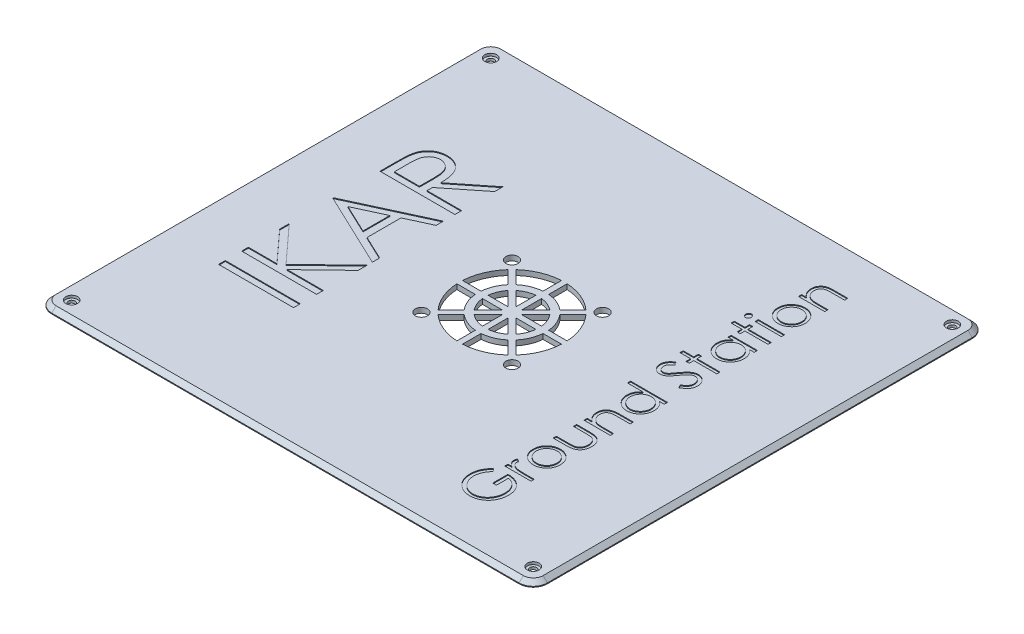
from build123d import *

# Parameters (mm, degrees)
SZKIC1_W                    = 175
SZKIC1_H                    = 160
DODANIE_WYCI_GNI_CIE1_DEPTH = 1.8
ZAOKR_GLENIE1_R             = 5
SZKIC2_R                    = 1.2
WYTNIJ_WYCI_GNI_CIE1_DEPTH  = 119.572720303
SZKIC3_R                    = 2.15
WYTNIJ_WYCI_GNI_CIE2_DEPTH  = 119.572720303
SZKIC5_R                    = 2.1
WYTNIJ_WYCI_GNI_CIE3_DEPTH  = 0.9
SFAZOWANIE2_SIZE            = 1.5
SZKIC6_W                    = 26.458333333
SZKIC6_H                    = 2.374465812
SZKIC6_W_2                  = 9.280769231
SZKIC6_H_2                  = 1.13974359
WYTNIJ_WYCI_GNI_CIE4_DEPTH  = 0.3


with BuildPart() as part:
    # Szkic1 → Dodanie-wyciągnięcie1 (new body)
    with BuildSketch(Plane(origin=(0, 0, 0), x_dir=(1, 0, 0), z_dir=(0, 1, 0))):
        Rectangle(SZKIC1_W, SZKIC1_H)
    extrude(amount=DODANIE_WYCI_GNI_CIE1_DEPTH)

    # Zaokrąglenie1
    zaokr_glenie1_edges = [part.edges().sort_by_distance(p)[0] for p in [
        (-87.5, 0.9, -80),
        (87.5, 0.9, -80),
        (87.5, 0.9, 80),
        (-87.5, 0.9, 80),
    ]]
    fillet(zaokr_glenie1_edges, radius=ZAOKR_GLENIE1_R)

    # Szkic2 → Wytnij-wyciągnięcie1 (cut, through all)
    with BuildSketch(Plane(origin=(0, 1.8, 0), x_dir=(1, 0, 0), z_dir=(0, 1, 0))):
        with Locations(Location((-81.5, 74, 0), (0, 0, 270))):
            Circle(SZKIC2_R)
        with Locations(Location((81.5, 74, 0), (0, 0, 270))):
            Circle(SZKIC2_R)
        with Locations(Location((81.5, -74, 0), (0, 0, 90))):
            Circle(SZKIC2_R)
        with Locations(Location((-81.5, -74, 0), (0, 0, 90))):
            Circle(SZKIC2_R)
    extrude(amount=-WYTNIJ_WYCI_GNI_CIE1_DEPTH, mode=Mode.SUBTRACT)

    # Szkic3 → Wytnij-wyciągnięcie2 (cut, through all)
    with BuildSketch(Plane(origin=(0, 1.8, 0), x_dir=(1, 0, 0), z_dir=(0, 1, 0))):
        with Locations(Location((-16, -16, 0), (0, 0, 270))):
            Circle(SZKIC3_R)
        with Locations(Location((16, -16, 0), (0, 0, 270))):
            Circle(SZKIC3_R)
        with Locations(Location((16, 16, 0), (0, 0, 270))):
            Circle(SZKIC3_R)
        with Locations(Location((-16, 16, 0), (0, 0, 270))):
            Circle(SZKIC3_R)
        with BuildLine():
            ThreePointArc((-13.769457259, 12.355243696), (-17.091771351, 7.079643499), (-18.472953202, 1))
            Line((-18.472953202, 1), (-11.958260743, 1))
            ThreePointArc((-11.958260743, 1), (-11.08655439, 4.592201188), (-9.162874044, 7.748660481))
            Line((-9.162874044, 7.748660481), (-13.769457259, 12.355243696))
        make_face()
        with BuildLine():
            ThreePointArc((-1, 18.472953202), (-7.079643499, 17.091771351), (-12.355243696, 13.769457259))
            Line((-12.355243696, 13.769457259), (-7.748660481, 9.162874044))
            ThreePointArc((-7.748660481, 9.162874044), (-4.592201188, 11.08655439), (-1, 11.958260743))
            Line((-1, 11.958260743), (-1, 18.472953202))
        make_face()
        with BuildLine():
            Line((7.748660481, 9.162874044), (12.355243696, 13.769457259))
            ThreePointArc((12.355243696, 13.769457259), (7.079643499, 17.091771351), (1, 18.472953202))
            Line((1, 18.472953202), (1, 11.958260743))
            ThreePointArc((1, 11.958260743), (4.592201188, 11.08655439), (7.748660481, 9.162874044))
        make_face()
        with BuildLine():
            Line((11.958260743, 1), (18.472953202, 1))
            ThreePointArc((18.472953202, 1), (17.091771351, 7.079643499), (13.769457259, 12.355243696))
            Line((13.769457259, 12.355243696), (9.162874044, 7.748660481))
            ThreePointArc((9.162874044, 7.748660481), (11.08655439, 4.592201188), (11.958260743, 1))
        make_face()
        with BuildLine():
            Line((9.162874044, -7.748660481), (13.769457259, -12.355243696))
            ThreePointArc((13.769457259, -12.355243696), (17.091771351, -7.079643499), (18.472953202, -1))
            Line((18.472953202, -1), (11.958260743, -1))
            ThreePointArc((11.958260743, -1), (11.08655439, -4.592201188), (9.162874044, -7.748660481))
        make_face()
        with BuildLine():
            ThreePointArc((7.748660481, -9.162874044), (4.592201188, -11.08655439), (1, -11.958260743))
            Line((1, -11.958260743), (1, -18.472953202))
            ThreePointArc((1, -18.472953202), (7.079643499, -17.091771351), (12.355243696, -13.769457259))
            Line((12.355243696, -13.769457259), (7.748660481, -9.162874044))
        make_face()
        with BuildLine():
            ThreePointArc((-18.472953202, -1), (-17.091771351, -7.079643499), (-13.769457259, -12.355243696))
            Line((-13.769457259, -12.355243696), (-9.162874044, -7.748660481))
            ThreePointArc((-9.162874044, -7.748660481), (-11.08655439, -4.592201188), (-11.958260743, -1))
            Line((-11.958260743, -1), (-18.472953202, -1))
        make_face()
        with BuildLine():
            ThreePointArc((-12.355243696, -13.769457259), (-7.079643499, -17.091771351), (-1, -18.472953202))
            Line((-1, -18.472953202), (-1, -11.958260743))
            ThreePointArc((-1, -11.958260743), (-4.592201188, -11.08655439), (-7.748660481, -9.162874044))
            Line((-7.748660481, -9.162874044), (-12.355243696, -13.769457259))
        make_face()
        with BuildLine():
            Line((-1, -2.414213562), (-5.973087827, -7.387301389))
            ThreePointArc((-5.973087827, -7.387301389), (-3.635492607, -8.776855559), (-1, -9.447221814))
            Line((-1, -9.447221814), (-1, -2.414213562))
        make_face()
        with BuildLine():
            Line((-2.414213562, -1), (-9.447221814, -1))
            ThreePointArc((-9.447221814, -1), (-8.776855559, -3.635492607), (-7.387301389, -5.973087827))
            Line((-7.387301389, -5.973087827), (-2.414213562, -1))
        make_face()
        with BuildLine():
            Line((-2.414213562, 1), (-7.387301389, 5.973087827))
            ThreePointArc((-7.387301389, 5.973087827), (-8.776855559, 3.635492607), (-9.447221814, 1))
            Line((-9.447221814, 1), (-2.414213562, 1))
        make_face()
        with BuildLine():
            Line((-1, 2.414213562), (-1, 9.447221814))
            ThreePointArc((-1, 9.447221814), (-3.635492607, 8.776855559), (-5.973087827, 7.387301389))
            Line((-5.973087827, 7.387301389), (-1, 2.414213562))
        make_face()
        with BuildLine():
            Line((1, 2.414213562), (5.973087827, 7.387301389))
            ThreePointArc((5.973087827, 7.387301389), (3.635492607, 8.776855559), (1, 9.447221814))
            Line((1, 9.447221814), (1, 2.414213562))
        make_face()
        with BuildLine():
            Line((2.414213562, 1), (9.447221814, 1))
            ThreePointArc((9.447221814, 1), (8.776855559, 3.635492607), (7.387301389, 5.973087827))
            Line((7.387301389, 5.973087827), (2.414213562, 1))
        make_face()
        with BuildLine():
            Line((2.414213562, -1), (7.387301389, -5.973087827))
            ThreePointArc((7.387301389, -5.973087827), (8.776855559, -3.635492607), (9.447221814, -1))
            Line((9.447221814, -1), (2.414213562, -1))
        make_face()
        with BuildLine():
            Line((1, -2.414213562), (1, -9.447221814))
            ThreePointArc((1, -9.447221814), (3.635492607, -8.776855559), (5.973087827, -7.387301389))
            Line((5.973087827, -7.387301389), (1, -2.414213562))
        make_face()
    extrude(amount=-WYTNIJ_WYCI_GNI_CIE2_DEPTH, mode=Mode.SUBTRACT)

    # Szkic5 → Wytnij-wyciągnięcie3 (cut)
    with BuildSketch(Plane(origin=(0, 1.8, 0), x_dir=(1, 0, 0), z_dir=(0, 1, 0))):
        with Locations(Location((81.5, 74, 0), (0, 0, 270))):
            Circle(SZKIC5_R)
        with Locations(Location((81.5, -74, 0), (0, 0, 270))):
            Circle(SZKIC5_R)
        with Locations(Location((-81.5, -74, 0), (0, 0, 270))):
            Circle(SZKIC5_R)
        with Locations(Location((-81.5, 74, 0), (0, 0, 270))):
            Circle(SZKIC5_R)
    extrude(amount=-WYTNIJ_WYCI_GNI_CIE3_DEPTH, mode=Mode.SUBTRACT)

    # Sfazowanie2
    sfazowanie2_edges = [part.edges().sort_by_distance(p)[0] for p in [
        (-87.5, 1.8, 0),
        (0, 1.8, -80),
        (0, 1.8, 80),
        (87.5, 1.8, 0),
        (-86.035533906, 1.8, 78.535533906),
        (86.035533906, 1.8, 78.535533906),
        (86.035533906, 1.8, -78.535533906),
        (-86.035533906, 1.8, -78.535533906),
    ]]
    chamfer(sfazowanie2_edges, length=SFAZOWANIE2_SIZE)

    # Szkic6 → Wytnij-wyciągnięcie4 (cut)
    # profile 1 of 18: a face of its own
    with BuildSketch(Plane.XZ.offset(-1.8)):
        with Locations((-53.229166666, 35.956196581)):
            Rectangle(SZKIC6_W, SZKIC6_H)
    # profile 2 of 18: a face of its own
    with BuildSketch(Plane.XZ.offset(-1.8)):
        Polygon((-66.458333333, 29.002403846), (-66.458333333, 26.627938034), (-56.382754073, 26.627938034), (-66.458333333, 15.598332332), (-66.458333333, 12.211538462), (-54.586004274, 25.212798811), (-40, 11.193910256), (-40, 14.358097957), (-52.768053886, 26.627938034), (-40, 26.627938034), (-40, 29.002403846), align=None)
    # profile 3 of 18: a face of its own
    with BuildSketch(Plane.XZ.offset(-1.8)):
        Polygon((-66.458333333, -3.561698718), (-40, -15.773237179), (-40, -13.192065638), (-48.480235043, -9.280557225), (-48.480235043, 2.713675214), (-40, 6.736486712), (-40, 9.328258547), (-66.458333333, -3.222489316), align=None)
        Polygon((-61.301290398, -3.365593283), (-51.193910256, 1.425739517), (-51.193910256, -8.029722556), align=None, mode=Mode.SUBTRACT)
    # profile 4 of 18: a face of its own
    with BuildSketch(Plane.XZ.offset(-1.8)):
        with BuildLine():
            Line((-66.458333333, -19.84375), (-66.458333333, -25.138596755))
            add(Edge.make_bspline(
                [(-66.458333333, -25.138596755), (-66.457157177, -25.491937429), (-66.454898828, -26.170390663), (-66.442306453, -27.142343362), (-66.406214598, -28.025500583), (-66.375155663, -28.819400559), (-66.318520154, -29.524028725), (-66.264389072, -30.141545744), (-66.19352866, -30.669107505), (-66.127719808, -30.988466024), (-66.097923344, -31.133062901)],
                knots=[0, 0, 0, 0, 1.410062039, 2.707475311, 3.878576406, 4.937260626, 5.877586885, 6.699081471, 7.410979367, 8, 8, 8, 8], degree=3))
            add(Edge.make_bspline(
                [(-66.097923344, -31.133062901), (-66.050095882, -31.326636635), (-65.955461247, -31.70965465), (-65.755441133, -32.261124595), (-65.523964458, -32.786611726), (-65.252120993, -33.283980842), (-64.937742116, -33.750564952), (-64.586814745, -34.191832031), (-64.200047676, -34.606349707), (-63.77395433, -34.988708196), (-63.317613246, -35.336023954), (-62.83227687, -35.64067337), (-62.319951965, -35.898096525), (-61.779840547, -36.100107627), (-61.217908962, -36.269617139), (-60.628421852, -36.383506649), (-60.013347107, -36.454448686), (-59.594841822, -36.461457062), (-59.38263722, -36.465010684)],
                knots=[0, 0, 0, 0, 1.02737844, 2.032840108, 3.019645024, 3.985760442, 4.950801802, 5.916702504, 6.889791722, 7.870143693, 8.864820395, 9.842884691, 10.820524757, 11.815201459, 12.812418953, 13.84314332, 14.906358105, 16, 16, 16, 16], degree=3))
            add(Edge.make_bspline(
                [(-59.38263722, -36.465010684), (-59.030098036, -36.453905758), (-58.342202779, -36.43223717), (-57.343885401, -36.230208113), (-56.412632844, -35.89927847), (-55.549617665, -35.44326313), (-54.771662191, -34.862544474), (-54.088353392, -34.164613018), (-53.516551672, -33.349079407), (-53.120033446, -32.589881602), (-52.866087053, -31.919244497), (-52.687407436, -31.36714743), (-52.549355674, -30.764903017), (-52.425680869, -30.1182815), (-52.332307941, -29.424591961), (-52.263919994, -28.68549702), (-52.221178079, -27.900469565), (-52.214812923, -27.361180171), (-52.211538462, -27.083750668)],
                knots=[0, 0, 0, 0, 1.260483769, 2.459530307, 3.627416485, 4.787058657, 5.939039949, 7.08810263, 8.267026773, 9.491475466, 10.141966685, 10.831826277, 11.566392101, 12.351337768, 13.187381173, 14.07005841, 15.007169909, 16, 16, 16, 16], degree=3))
            Line((-52.211538462, -27.083750668), (-40, -36.804220085))
            Line((-40, -36.804220085), (-40, -33.867938702))
            Line((-40, -33.867938702), (-52.211538462, -24.147469284))
            Line((-52.211538462, -24.147469284), (-52.211538462, -22.218215812))
            Line((-52.211538462, -22.218215812), (-40, -22.218215812))
            Line((-40, -22.218215812), (-40, -19.84375))
            Line((-40, -19.84375), (-66.458333333, -19.84375))
        make_face()
        with BuildLine():
            Line((-63.74465812, -22.218215812), (-54.925213675, -22.218215812))
            Line((-54.925213675, -22.218215812), (-54.888112647, -27.06255008))
            add(Edge.make_bspline(
                [(-54.888112647, -27.06255008), (-54.888012526, -27.288731356), (-54.887818463, -27.727135089), (-54.918010297, -28.361383764), (-54.95235294, -28.951935965), (-55.004895625, -29.496525217), (-55.07256988, -29.995420102), (-55.157354938, -30.448288441), (-55.255710039, -30.856139668), (-55.409518191, -31.330271653), (-55.64255736, -31.865972619), (-56.004509058, -32.435434225), (-56.43942065, -32.935091096), (-56.95109765, -33.342024507), (-57.504747758, -33.682968409), (-58.106041383, -33.912410094), (-58.735473144, -34.065323236), (-59.167941784, -34.08204073), (-59.387937366, -34.090544872)],
                knots=[0, 0, 0, 0, 1.146477201, 2.22219935, 3.21835465, 4.145220026, 4.995151787, 5.769831222, 6.480173269, 7.120302478, 8.295254187, 9.430763426, 10.528629691, 11.636497428, 12.733230534, 13.811001502, 14.886462612, 16, 16, 16, 16], degree=3))
            add(Edge.make_bspline(
                [(-59.387937366, -34.090544872), (-59.600694711, -34.08143118), (-60.022302135, -34.063371169), (-60.639836287, -33.916732265), (-61.222845842, -33.666038394), (-61.772083549, -33.336249494), (-62.262857698, -32.922363017), (-62.687330624, -32.446381142), (-63.034820154, -31.908395468), (-63.265774282, -31.410003528), (-63.401403455, -30.960962362), (-63.499982989, -30.572939297), (-63.568400861, -30.132354546), (-63.633205059, -29.641211752), (-63.685665807, -29.098573596), (-63.721852517, -28.502849657), (-63.743045081, -27.857730251), (-63.744107927, -27.410609637), (-63.74465812, -27.179153312)],
                knots=[0, 0, 0, 0, 1.100823979, 2.181431445, 3.263702604, 4.376021382, 5.48638238, 6.575013887, 7.666064109, 8.791843368, 9.405226397, 10.093019944, 10.863016055, 11.711746407, 12.658404307, 13.684961631, 14.801597923, 16, 16, 16, 16], degree=3))
            Line((-63.74465812, -27.179153312), (-63.74465812, -22.218215812))
        make_face(mode=Mode.SUBTRACT)
    # profile 5 of 18: a face of its own
    with BuildSketch(Plane.XZ.offset(-1.8)):
        with BuildLine():
            Line((44.467548077, 51.044230769), (45.393589744, 52.021153846))
            add(Edge.make_bspline(
                [(45.393589744, 52.021153846), (45.227233452, 52.197898223), (44.898487729, 52.547172408), (44.472628646, 53.117583628), (44.104209162, 53.71033201), (43.806682307, 54.326375988), (43.573286565, 54.94956136), (43.403629211, 55.56917242), (43.296186632, 56.181197388), (43.283281911, 56.588193571), (43.276923077, 56.788741987)],
                knots=[0, 0, 0, 0, 1.089067066, 2.152164705, 3.18986567, 4.218445106, 5.218487318, 6.173592265, 7.100032889, 8, 8, 8, 8], degree=3))
            add(Edge.make_bspline(
                [(43.276923077, 56.788741987), (43.278423875, 56.911803898), (43.28142158, 57.157608554), (43.319682018, 57.522722465), (43.374708811, 57.88400712), (43.454326482, 58.240780507), (43.555233638, 58.593736322), (43.681455187, 58.941646973), (43.828612744, 59.285161548), (43.998656744, 59.621043959), (44.185454427, 59.94667462), (44.392461383, 60.254217808), (44.61302963, 60.545651826), (44.852730431, 60.815433233), (45.109213472, 61.065356586), (45.377859718, 61.300018841), (45.663951063, 61.515046454), (45.966311037, 61.706582919), (46.277905367, 61.879548188), (46.59609143, 62.029017028), (46.917915423, 62.158956005), (47.24580063, 62.257921519), (47.576366686, 62.341744693), (47.911345918, 62.400096606), (48.251613088, 62.43310324), (48.479479019, 62.43880188), (48.594030449, 62.441666667)],
                knots=[0, 0, 0, 0, 1.028150113, 2.053633673, 3.06513288, 4.081487945, 5.106702018, 6.131327874, 7.172780699, 8.228344599, 9.276313556, 10.308389736, 11.324843658, 12.329040066, 13.321460474, 14.316307835, 15.308626991, 16.309440696, 17.305625405, 18.28535951, 19.246194545, 20.203493668, 21.145557131, 22.095268976, 23.042464743, 24, 24, 24, 24], degree=3))
            add(Edge.make_bspline(
                [(48.594030449, 62.441666667), (48.711126848, 62.438922758), (48.944999895, 62.433442434), (49.294055411, 62.398415119), (49.637886439, 62.333263357), (49.977033781, 62.246860722), (50.312172397, 62.137014156), (50.642952545, 62.002058465), (50.969342067, 61.841290497), (51.28810088, 61.655611894), (51.598344218, 61.450563252), (51.893029498, 61.225043241), (52.168727333, 60.978672181), (52.429464655, 60.715967443), (52.673595951, 60.434535458), (52.898178585, 60.131645786), (53.106685296, 59.811538321), (53.296825471, 59.474071058), (53.466669347, 59.122810903), (53.617705766, 58.762651852), (53.742090486, 58.392436324), (53.843465974, 58.014111791), (53.926561316, 57.628128754), (53.980019179, 57.232528105), (54.018811621, 56.830218561), (54.021647967, 56.559024096), (54.023076923, 56.422395833)],
                knots=[0, 0, 0, 0, 0.935915162, 1.869274651, 2.799799983, 3.730201895, 4.664668062, 5.616159355, 6.583070886, 7.570012957, 8.562524459, 9.553461134, 10.53281078, 11.515274572, 12.509912756, 13.507571325, 14.526460018, 15.561318395, 16.601025881, 17.643204557, 18.680545676, 19.719612342, 20.772381578, 21.833430283, 22.908478249, 24, 24, 24, 24], degree=3))
            add(Edge.make_bspline(
                [(54.023076923, 56.422395833), (54.019636374, 56.257736589), (54.012880296, 55.93440141), (53.960244705, 55.459117261), (53.878142942, 55.00259719), (53.757532671, 54.56632738), (53.604869786, 54.148724546), (53.416080368, 53.751328889), (53.193150791, 53.373043084), (52.940595349, 53.015504481), (52.659205199, 52.687213033), (52.35827069, 52.38842892), (52.033892981, 52.129426491), (51.69090644, 51.902469082), (51.326030333, 51.714881942), (50.941294492, 51.56086404), (50.536460857, 51.442817699), (50.256728767, 51.394357804), (50.115384615, 51.369871795)],
                knots=[0, 0, 0, 0, 1.130199668, 2.219330667, 3.279027493, 4.311506524, 5.322739849, 6.327972234, 7.327472899, 8.33386792, 9.329086447, 10.29244429, 11.240784345, 12.174119183, 13.111530729, 14.052100829, 15.015757696, 16, 16, 16, 16], degree=3))
            Line((50.115384615, 51.369871795), (50.115384615, 55.603205128))
            Line((50.115384615, 55.603205128), (48.812820513, 55.603205128))
            Line((48.812820513, 55.603205128), (48.812820513, 50.230128205))
            add(Edge.make_bspline(
                [(48.812820513, 50.230128205), (49.055599115, 50.236317998), (49.530760695, 50.24843254), (50.223709964, 50.333409748), (50.878201537, 50.470629664), (51.494924682, 50.658082796), (52.073005433, 50.900744527), (52.613030719, 51.196010559), (53.111511818, 51.548606541), (53.572518203, 51.945973001), (53.983741344, 52.391924276), (54.345168604, 52.874410411), (54.649615237, 53.394228554), (54.897303927, 53.950886998), (55.090612422, 54.542563428), (55.227669286, 55.170626977), (55.309783725, 55.834225928), (55.320275301, 56.289019013), (55.325641026, 56.521614583)],
                knots=[0, 0, 0, 0, 1.140356446, 2.231883559, 3.274166699, 4.278491846, 5.25512956, 6.21435461, 7.1637429, 8.11826594, 9.068280886, 10.0076534, 10.945064095, 11.891975133, 12.864533718, 13.863980011, 14.907571808, 16, 16, 16, 16], degree=3))
            add(Edge.make_bspline(
                [(55.325641026, 56.521614583), (55.323575929, 56.664979932), (55.319502892, 56.947742604), (55.290556517, 57.365358258), (55.245995568, 57.771459338), (55.178703263, 58.165986685), (55.096281518, 58.550391526), (54.990738281, 58.92275402), (54.868569001, 59.284492627), (54.729610414, 59.636166461), (54.568604689, 59.97458353), (54.38968114, 60.301251178), (54.193762374, 60.61797512), (53.977460162, 60.922597918), (53.742392378, 61.216706773), (53.488087872, 61.498405269), (53.215324095, 61.769270426), (53.021634545, 61.938944108), (52.924038462, 62.024439103)],
                knots=[0, 0, 0, 0, 1.107784379, 2.184907829, 3.233506516, 4.263428166, 5.276301166, 6.270063455, 7.25232949, 8.225834625, 9.190232166, 10.146266622, 11.1027726, 12.066435141, 13.031522626, 14.010570082, 14.99756817, 16, 16, 16, 16], degree=3))
            add(Edge.make_bspline(
                [(52.924038462, 62.024439103), (52.769204949, 62.148485198), (52.462108001, 62.394518353), (51.970073917, 62.711213378), (51.460615739, 62.981184183), (50.93231523, 63.200233137), (50.385666544, 63.371277051), (49.821368201, 63.493945454), (49.238693542, 63.565817617), (48.844393867, 63.576171882), (48.644911859, 63.581410256)],
                knots=[0, 0, 0, 0, 1.023165419, 2.029347347, 3.013907458, 3.994755782, 4.975994455, 5.96558838, 6.970761222, 8, 8, 8, 8], degree=3))
            add(Edge.make_bspline(
                [(48.644911859, 63.581410256), (48.49553717, 63.579478993), (48.198686254, 63.57564101), (47.757969744, 63.529102703), (47.325078641, 63.462331864), (46.900366925, 63.364189619), (46.483550501, 63.240469172), (46.074437497, 63.086059738), (45.672780209, 62.906286603), (45.281366984, 62.697318199), (44.90530324, 62.46484021), (44.546429291, 62.212263859), (44.210561395, 61.937640202), (43.89692151, 61.640169573), (43.60086109, 61.325848454), (43.328564382, 60.988078162), (43.07577039, 60.6319762), (42.847336541, 60.254782063), (42.642076042, 59.862447745), (42.462142155, 59.455826091), (42.313430157, 59.035064866), (42.187251316, 58.603310015), (42.093942009, 58.157295163), (42.026273727, 57.700256479), (41.979970974, 57.229811793), (41.976247132, 56.9118182), (41.974358974, 56.750580929)],
                knots=[0, 0, 0, 0, 1.00895651, 2.005089799, 2.991467152, 3.967318338, 4.948153826, 5.927364234, 6.919980553, 7.91976625, 8.923240147, 9.905815003, 10.88314567, 11.851989312, 12.825009789, 13.798721852, 14.781296708, 15.773896486, 16.776076962, 17.771600213, 18.775744723, 19.78957137, 20.808953803, 21.851964491, 22.910847925, 24, 24, 24, 24], degree=3))
            add(Edge.make_bspline(
                [(41.974358974, 56.750580929), (41.976461702, 56.619087874), (41.980631162, 56.358352597), (42.009531457, 55.97036494), (42.055338111, 55.588374286), (42.117846737, 55.211814243), (42.202986414, 54.841967143), (42.304870475, 54.477779383), (42.423495089, 54.118723037), (42.564968902, 53.76592339), (42.725546341, 53.417008249), (42.906297903, 53.070037571), (43.110314348, 52.726196878), (43.338201463, 52.384889889), (43.586045293, 52.043964347), (43.860934339, 51.708812645), (44.152028339, 51.371344819), (44.361332263, 51.154349664), (44.467548077, 51.044230769)],
                knots=[0, 0, 0, 0, 0.985871117, 1.954866573, 2.915460327, 3.869826059, 4.81536089, 5.759505086, 6.70452669, 7.649098992, 8.607881297, 9.583363685, 10.581137262, 11.603961102, 12.659522466, 13.73993555, 14.853081303, 16, 16, 16, 16], degree=3))
        make_face()
    # profile 6 of 18: a face of its own
    with BuildSketch(Plane.XZ.offset(-1.8)):
        with BuildLine():
            Line((45.719230769, 48.276282051), (45.719230769, 47.136538462))
            Line((45.719230769, 47.136538462), (47.085396635, 47.136538462))
            add(Edge.make_bspline(
                [(47.085396635, 47.136538462), (46.958137112, 47.052450232), (46.714754264, 46.891632146), (46.393296876, 46.623082236), (46.124103488, 46.350940924), (45.91230766, 46.06806228), (45.752241733, 45.777219706), (45.63976842, 45.480865725), (45.570020297, 45.178275646), (45.560953014, 44.974438969), (45.556410256, 44.872315705)],
                knots=[0, 0, 0, 0, 1.280091057, 2.448164201, 3.510831157, 4.48793739, 5.405868014, 6.289422536, 7.142991551, 8, 8, 8, 8], degree=3))
            add(Edge.make_bspline(
                [(45.556410256, 44.872315705), (45.560730167, 44.79311732), (45.569618664, 44.630161497), (45.632069371, 44.383481814), (45.731775338, 44.129324146), (45.825538432, 43.965521769), (45.874419071, 43.880128205)],
                knots=[0, 0, 0, 0, 0.901110191, 1.854092781, 2.881294221, 4, 4, 4, 4], degree=3))
            Line((45.874419071, 43.880128205), (46.861518429, 44.505969551))
            add(Edge.make_bspline(
                [(46.861518429, 44.505969551), (46.837060892, 44.560793714), (46.790635805, 44.664860469), (46.73569194, 44.81709561), (46.703339902, 44.957453603), (46.698438728, 45.046874515), (46.696153846, 45.088561699)],
                knots=[0, 0, 0, 0, 1.180555205, 2.24091978, 3.179933427, 4, 4, 4, 4], degree=3))
            add(Edge.make_bspline(
                [(46.696153846, 45.088561699), (46.702202242, 45.180049963), (46.714539215, 45.366659502), (46.812912201, 45.639714342), (46.967281857, 45.907050703), (47.143063255, 46.117320009), (47.31191666, 46.280703201), (47.459700625, 46.398204249), (47.626944401, 46.503663188), (47.807183644, 46.605961159), (48.004941845, 46.701003698), (48.220541623, 46.785938168), (48.452202637, 46.865368249), (48.61328194, 46.91009961), (48.695793269, 46.933012821)],
                knots=[0, 0, 0, 0, 1.125322384, 2.295331465, 3.535939348, 4.916963136, 5.656144286, 6.429838446, 7.238666481, 8.090384391, 8.983239461, 9.940052224, 10.944811494, 12, 12, 12, 12], degree=3))
            add(Edge.make_bspline(
                [(48.695793269, 46.933012821), (48.769366369, 46.950214325), (48.933142387, 46.988505411), (49.206654665, 47.02474175), (49.529592541, 47.061986799), (49.90233117, 47.087421417), (50.326303367, 47.111447806), (50.799680117, 47.124720974), (51.323762502, 47.136116156), (51.689307909, 47.136393202), (51.880969551, 47.136538462)],
                knots=[0, 0, 0, 0, 0.566841273, 1.261806378, 2.068780918, 3.007109044, 4.065315289, 5.256255371, 6.561408263, 8, 8, 8, 8], degree=3))
            Line((51.880969551, 47.136538462), (55, 47.136538462))
            Line((55, 47.136538462), (55, 48.276282051))
            Line((55, 48.276282051), (45.719230769, 48.276282051))
        make_face()
    # profile 7 of 18: a face of its own
    with BuildSketch(Plane.XZ.offset(-1.8)):
        with BuildLine():
            add(Edge.make_bspline(
                [(45.556410256, 38.094911859), (45.560118261, 37.920772098), (45.567388753, 37.579326583), (45.645094486, 37.079280826), (45.763920636, 36.601959904), (45.928191733, 36.145535721), (46.148380525, 35.715853734), (46.41112281, 35.30665522), (46.722391078, 34.919062074), (46.963176069, 34.686749939), (47.085396635, 34.568830128)],
                knots=[0, 0, 0, 0, 1.054011418, 2.066658804, 3.057071809, 4.030435133, 4.997543892, 5.974964718, 6.972108034, 8, 8, 8, 8], degree=3))
            add(Edge.make_bspline(
                [(47.085396635, 34.568830128), (47.202287383, 34.467295609), (47.433806722, 34.266191544), (47.809202803, 34.008324507), (48.197968311, 33.786177703), (48.605265754, 33.608149245), (49.02753956, 33.467777873), (49.466241144, 33.368116632), (49.920401661, 33.308836897), (50.228844159, 33.300843274), (50.38505609, 33.296794872)],
                knots=[0, 0, 0, 0, 1.025258237, 2.030674902, 3.01204498, 3.988269485, 4.97094183, 5.956517959, 6.965070386, 8, 8, 8, 8], degree=3))
            add(Edge.make_bspline(
                [(50.38505609, 33.296794872), (50.542173442, 33.300355724), (50.852644657, 33.307392135), (51.309914927, 33.373953257), (51.75330757, 33.47748034), (52.180966258, 33.625641582), (52.594198232, 33.815626721), (52.991198597, 34.047458644), (53.372750623, 34.322764227), (53.735614436, 34.634835872), (54.07004613, 34.979738394), (54.361522994, 35.353902704), (54.611246811, 35.749975912), (54.812401804, 36.173224651), (54.971005574, 36.619783817), (55.082402777, 37.090616607), (55.149755172, 37.584991577), (55.158404138, 37.922547494), (55.162820513, 38.094911859)],
                knots=[0, 0, 0, 0, 0.998656419, 1.973391657, 2.932242238, 3.890759089, 4.846373663, 5.82037756, 6.809684879, 7.83454468, 8.860553229, 9.859544525, 10.845671541, 11.83227036, 12.833544569, 13.85385346, 14.904124723, 16, 16, 16, 16], degree=3))
            add(Edge.make_bspline(
                [(55.162820513, 38.094911859), (55.158389315, 38.268120698), (55.149710591, 38.607358961), (55.08266445, 39.103478952), (54.971056914, 39.57515557), (54.811880583, 40.022299341), (54.611240381, 40.447367786), (54.362277965, 40.845735932), (54.069959687, 41.220204197), (53.735637858, 41.565179683), (53.372744588, 41.877231765), (52.991200163, 42.152542396), (52.594197824, 42.384373008), (52.180966367, 42.57435849), (51.75330754, 42.72251964), (51.309914935, 42.826046748), (50.852644655, 42.892607864), (50.542173441, 42.899644275), (50.38505609, 42.903205128)],
                knots=[0, 0, 0, 0, 1.099876186, 2.154163076, 3.173186993, 4.173200201, 5.163417411, 6.152872554, 7.150605724, 8.17532212, 9.198891216, 10.186952605, 11.159729845, 12.11414092, 13.071450619, 14.029093627, 15.002601286, 16, 16, 16, 16], degree=3))
            add(Edge.make_bspline(
                [(50.38505609, 42.903205128), (50.229689728, 42.8991388), (49.922091033, 42.891088169), (49.468834567, 42.831727536), (49.031475664, 42.733150686), (48.611507811, 42.590833365), (48.205189299, 42.413135383), (47.814998367, 42.19322439), (47.44124261, 41.932862922), (47.210030292, 41.732540141), (47.093028846, 41.631169872)],
                knots=[0, 0, 0, 0, 1.031377469, 2.041950136, 3.029500481, 4.003457997, 4.981637986, 5.969878303, 6.97268806, 8, 8, 8, 8], degree=3))
            add(Edge.make_bspline(
                [(47.093028846, 41.631169872), (46.969748352, 41.513427842), (46.727295569, 41.281867421), (46.416934696, 40.892344895), (46.148724942, 40.48415303), (45.932911246, 40.049722583), (45.762954339, 39.593673356), (45.644788041, 39.11390639), (45.567668724, 38.612163806), (45.560200479, 38.269047466), (45.556410256, 38.094911859)],
                knots=[0, 0, 0, 0, 1.027980169, 2.021703884, 2.998553061, 3.971491411, 4.943284454, 5.930300938, 6.949603206, 8, 8, 8, 8], degree=3))
        make_face()
        with BuildLine():
            add(Edge.make_bspline(
                [(46.696153846, 38.1), (46.699653936, 38.223145047), (46.706563761, 38.466256172), (46.759119645, 38.824104375), (46.842386297, 39.168601519), (46.960692467, 39.500401103), (47.113451242, 39.81838452), (47.30107905, 40.122855053), (47.521088788, 40.414712718), (47.773143993, 40.688231026), (48.048458016, 40.939304413), (48.341888261, 41.158607059), (48.648939981, 41.346134441), (48.970075235, 41.499520706), (49.306388973, 41.617157079), (49.655900635, 41.700516448), (50.019665623, 41.753168566), (50.267000341, 41.759993377), (50.392688301, 41.763461538)],
                knots=[0, 0, 0, 0, 1.02155314, 2.01673505, 2.994700672, 3.958461264, 4.934171024, 5.916582427, 6.921469794, 7.962398674, 8.998583302, 10.009097305, 10.997513862, 11.97957236, 12.956600784, 13.948243505, 14.957359924, 16, 16, 16, 16], degree=3))
            add(Edge.make_bspline(
                [(50.392688301, 41.763461538), (50.555074228, 41.757631064), (50.877379928, 41.746058663), (51.352037431, 41.651950805), (51.807720151, 41.494520589), (52.241756752, 41.28193246), (52.643339018, 41.015572752), (53.001375547, 40.701748253), (53.310478348, 40.343827055), (53.566948845, 39.946075754), (53.77072853, 39.516618658), (53.915141956, 39.06211715), (54.00901924, 38.58807806), (54.018350018, 38.26411655), (54.023076923, 38.1)],
                knots=[0, 0, 0, 0, 1.016792936, 2.018143844, 3.017858371, 4.030088057, 5.03801393, 6.028138512, 7.003788237, 7.991172063, 8.984598303, 9.972568034, 10.972917682, 12, 12, 12, 12], degree=3))
            add(Edge.make_bspline(
                [(54.023076923, 38.1), (54.018322478, 37.93589289), (54.008937334, 37.611950013), (53.91561476, 37.138569571), (53.770095762, 36.685310302), (53.567178029, 36.256299267), (53.30950441, 35.858729021), (53.003120985, 35.498233638), (52.642390724, 35.187088677), (52.241224834, 34.920992454), (51.808393042, 34.704922844), (51.351953328, 34.548229512), (50.877401347, 34.453895415), (50.555081404, 34.442353551), (50.392688301, 34.436538462)],
                knots=[0, 0, 0, 0, 1.02726834, 2.027799167, 3.010890988, 4.004497153, 4.992059811, 5.971914811, 6.958719428, 7.966827853, 8.981595046, 9.981490638, 10.983022906, 12, 12, 12, 12], degree=3))
            add(Edge.make_bspline(
                [(50.392688301, 34.436538462), (50.26699959, 34.440005426), (50.019663395, 34.446827884), (49.65590915, 34.499497125), (49.306357818, 34.582793262), (48.970189963, 34.70066216), (48.648106795, 34.853367093), (48.342788321, 35.044499471), (48.047441791, 35.262906393), (47.774034014, 35.517008934), (47.520990538, 35.79024176), (47.300993735, 36.082217697), (47.114275847, 36.386236754), (46.95938586, 36.703296372), (46.843462631, 37.035138496), (46.75863886, 37.379152949), (46.706785859, 37.735474342), (46.699720517, 37.977714299), (46.696153846, 38.1)],
                knots=[0, 0, 0, 0, 1.042975879, 2.052417305, 3.044379404, 4.0217225, 5.00409729, 5.996508862, 7.007348322, 8.048612455, 9.089876587, 10.095087598, 11.077815406, 12.047498138, 13.018202342, 13.98964644, 14.985148868, 16, 16, 16, 16], degree=3))
        make_face(mode=Mode.SUBTRACT)
    # profile 8 of 18: a face of its own
    with BuildSketch(Plane.XZ.offset(-1.8)):
        with BuildLine():
            Line((45.719230769, 31.180128205), (45.719230769, 30.040384615))
            Line((45.719230769, 30.040384615), (50.023798077, 30.040384615))
            add(Edge.make_bspline(
                [(50.023798077, 30.040384615), (50.15015491, 30.039869703), (50.391869612, 30.038884701), (50.739687004, 30.032204715), (51.05688479, 30.016492661), (51.343646206, 29.996848212), (51.599922741, 29.971585604), (51.824819265, 29.941528839), (52.020886162, 29.907933994), (52.138972053, 29.875049289), (52.193890224, 29.859755609)],
                knots=[0, 0, 0, 0, 1.388932606, 2.656963016, 3.823490214, 4.879454478, 5.816252168, 6.653371382, 7.373723809, 8, 8, 8, 8], degree=3))
            add(Edge.make_bspline(
                [(52.193890224, 29.859755609), (52.26291607, 29.835221187), (52.399532732, 29.786662406), (52.596887122, 29.698584337), (52.779677433, 29.589624372), (52.954952211, 29.47039014), (53.117519421, 29.332869432), (53.267104533, 29.178802209), (53.409359379, 29.013345748), (53.57766991, 28.767491807), (53.758065536, 28.431271041), (53.913716077, 27.989845329), (54.006737481, 27.511221424), (54.017529778, 27.180423728), (54.023076923, 27.010396635)],
                knots=[0, 0, 0, 0, 0.725840625, 1.436591201, 2.137033971, 2.831655856, 3.53531722, 4.242432219, 4.957935707, 5.694543706, 7.190802206, 8.724350549, 10.316345118, 12, 12, 12, 12], degree=3))
            add(Edge.make_bspline(
                [(54.023076923, 27.010396635), (54.017411821, 26.840385335), (54.006450897, 26.511444927), (53.916522057, 26.038079753), (53.766278556, 25.605367478), (53.556520234, 25.217651169), (53.299827606, 24.876689406), (52.998624214, 24.592556229), (52.662439296, 24.358124191), (52.411616913, 24.255764294), (52.285476763, 24.204286859)],
                knots=[0, 0, 0, 0, 1.157059328, 2.238695713, 3.266970494, 4.264342957, 5.228770407, 6.160125903, 7.074715775, 8, 8, 8, 8], degree=3))
            add(Edge.make_bspline(
                [(52.285476763, 24.204286859), (52.234799051, 24.189067796), (52.122763005, 24.155422163), (51.932699347, 24.119273059), (51.706042068, 24.086708584), (51.441307996, 24.058902202), (51.139188957, 24.039071469), (50.799779367, 24.028381601), (50.424144717, 24.016304717), (50.161190276, 24.016121415), (50.023798077, 24.016025641)],
                knots=[0, 0, 0, 0, 0.557542046, 1.232589297, 2.036731608, 2.971723315, 4.038036528, 5.22795436, 6.551621927, 8, 8, 8, 8], degree=3))
            Line((50.023798077, 24.016025641), (45.719230769, 24.016025641))
            Line((45.719230769, 24.016025641), (45.719230769, 22.876282051))
            Line((45.719230769, 22.876282051), (50.2375, 22.876282051))
            add(Edge.make_bspline(
                [(50.2375, 22.876282051), (50.391013738, 22.877890531), (50.688851388, 22.881011203), (51.121693949, 22.900916656), (51.525851548, 22.935546273), (51.900087747, 22.986750559), (52.244489476, 23.048871195), (52.55917365, 23.127413975), (52.844549392, 23.221726734), (53.10487642, 23.328047796), (53.340886347, 23.453694803), (53.564960473, 23.587264585), (53.771174642, 23.74178665), (53.970683412, 23.903056472), (54.149541212, 24.086667931), (54.321922461, 24.278495882), (54.476791384, 24.489087323), (54.61928329, 24.712329555), (54.747062596, 24.950325271), (54.859499382, 25.202495394), (54.953132657, 25.469855768), (55.029447444, 25.752307648), (55.090405724, 26.048752495), (55.133087158, 26.359791503), (55.159328927, 26.685144887), (55.161637108, 26.906886094), (55.162820513, 27.020572917)],
                knots=[0, 0, 0, 0, 1.493202592, 2.897017285, 4.213619731, 5.437335819, 6.569830554, 7.616136122, 8.589086983, 9.491357706, 10.347307, 11.187612773, 12.025729508, 12.851620453, 13.679855991, 14.515574443, 15.358588344, 16.218977568, 17.089938093, 17.983570823, 18.901874366, 19.842360053, 20.827541903, 21.843594624, 22.894409941, 24, 24, 24, 24], degree=3))
            add(Edge.make_bspline(
                [(55.162820513, 27.020572917), (55.161589585, 27.13340944), (55.159170698, 27.355143712), (55.133231737, 27.680513727), (55.090472497, 27.99241488), (55.029001159, 28.289560577), (54.953687202, 28.573148483), (54.858921772, 28.841801804), (54.747076066, 29.095859794), (54.619839816, 29.335869077), (54.476528974, 29.561033378), (54.318799353, 29.770846609), (54.150766295, 29.9690492), (53.966699074, 30.150139308), (53.767975781, 30.315445149), (53.55548942, 30.465683379), (53.33164153, 30.603423665), (53.091922901, 30.728072002), (52.828591253, 30.835158442), (52.537227178, 30.929701484), (52.214638144, 31.007028742), (51.861099403, 31.069957102), (51.478303118, 31.120580909), (51.064034865, 31.155727765), (50.619303754, 31.175379495), (50.312145582, 31.178511175), (50.153545673, 31.180128205)],
                knots=[0, 0, 0, 0, 1.083759936, 2.129689164, 3.133164553, 4.10615121, 5.04285688, 5.949793092, 6.839814394, 7.707177441, 8.556916231, 9.400895077, 10.227072161, 11.05083587, 11.877976332, 12.707560346, 13.548664154, 14.401248865, 15.299878211, 16.27626931, 17.341250723, 18.483766318, 19.724630785, 21.049282549, 22.476408703, 24, 24, 24, 24], degree=3))
            Line((50.153545673, 31.180128205), (45.719230769, 31.180128205))
        make_face()
    # profile 9 of 18: a face of its own
    with BuildSketch(Plane.XZ.offset(-1.8)):
        with BuildLine():
            Line((45.719230769, 20.271153846), (45.719230769, 19.131410256))
            Line((45.719230769, 19.131410256), (47.393229167, 19.131410256))
            add(Edge.make_bspline(
                [(47.393229167, 19.131410256), (47.241172836, 19.009926623), (46.946565678, 18.774553666), (46.562400864, 18.378543586), (46.240025133, 17.965622894), (45.986200596, 17.529085107), (45.794232468, 17.073422291), (45.655800824, 16.599927383), (45.572746507, 16.106037584), (45.5618983, 15.770159257), (45.556410256, 15.600240385)],
                knots=[0, 0, 0, 0, 1.127869841, 2.185233117, 3.191641716, 4.159226741, 5.10472073, 6.052603964, 7.014823782, 8, 8, 8, 8], degree=3))
            add(Edge.make_bspline(
                [(45.556410256, 15.600240385), (45.562375606, 15.428411161), (45.574057087, 15.091931338), (45.677283357, 14.603860822), (45.839686658, 14.145228563), (46.070281581, 13.722794726), (46.355057961, 13.341090904), (46.687325558, 13.007061667), (47.067506526, 12.728527165), (47.4222773, 12.54235175), (47.737542256, 12.422043799), (48.007175695, 12.342964515), (48.307708289, 12.278992827), (48.638389334, 12.221670003), (49.000549354, 12.183429805), (49.393323258, 12.1531172), (49.816643252, 12.131435471), (50.109419996, 12.130572971), (50.260396635, 12.130128205)],
                knots=[0, 0, 0, 0, 1.235846195, 2.420061613, 3.574938557, 4.72781258, 5.870749808, 6.993217613, 8.10690044, 9.251157787, 9.865716151, 10.534141144, 11.271861846, 12.076851687, 12.949307443, 13.892392281, 14.913166647, 16, 16, 16, 16], degree=3))
            Line((50.260396635, 12.130128205), (55, 12.130128205))
            Line((55, 12.130128205), (55, 13.269871795))
            Line((55, 13.269871795), (50.634375, 13.269871795))
            add(Edge.make_bspline(
                [(50.634375, 13.269871795), (50.50801909, 13.270569963), (50.266321738, 13.271905439), (49.92027078, 13.276172722), (49.607286722, 13.286217706), (49.326470074, 13.300913085), (49.078848644, 13.321482907), (48.863169024, 13.343503274), (48.681341652, 13.370210738), (48.571885637, 13.394026547), (48.522796474, 13.404707532)],
                knots=[0, 0, 0, 0, 1.430803381, 2.736883362, 3.918614142, 4.976458302, 5.92063272, 6.731858525, 7.431260095, 8, 8, 8, 8], degree=3))
            add(Edge.make_bspline(
                [(48.522796474, 13.404707532), (48.378598083, 13.443071649), (48.101798915, 13.516714328), (47.726984359, 13.702388388), (47.405288612, 13.931415356), (47.143327768, 14.215174519), (46.939397991, 14.546044802), (46.798009301, 14.924576252), (46.709549252, 15.346851259), (46.70074354, 15.643867652), (46.696153846, 15.798677885)],
                knots=[0, 0, 0, 0, 1.084232, 2.08126119, 3.027460722, 3.945137793, 4.874029258, 5.839697328, 6.874011781, 8, 8, 8, 8], degree=3))
            add(Edge.make_bspline(
                [(46.696153846, 15.798677885), (46.697856217, 15.890371628), (46.701225166, 16.071831178), (46.735882161, 16.340770825), (46.790669013, 16.602442409), (46.871409421, 16.856250217), (46.970511116, 17.10301798), (47.089733875, 17.34447772), (47.236500631, 17.575057248), (47.40057853, 17.798550868), (47.582267495, 18.006524889), (47.774024566, 18.200027882), (47.978222785, 18.372523688), (48.191583077, 18.528801267), (48.417032762, 18.6637053), (48.652397565, 18.781463635), (48.897987067, 18.881378874), (49.068439434, 18.931027501), (49.153725962, 18.955869391)],
                knots=[0, 0, 0, 0, 1.023827899, 2.026128959, 3.023898047, 4.006668367, 4.997079741, 5.992687789, 7.009920206, 8.046337072, 9.087246971, 10.092051999, 11.086713115, 12.070168086, 13.043348831, 14.017773728, 15.008185103, 16, 16, 16, 16], degree=3))
            add(Edge.make_bspline(
                [(49.153725962, 18.955869391), (49.216337698, 18.970164687), (49.352640174, 19.001284799), (49.576321353, 19.034896909), (49.835074691, 19.065404397), (50.128598241, 19.090938504), (50.457919674, 19.106561015), (50.821632571, 19.123594969), (51.221187229, 19.129796419), (51.499359657, 19.130857247), (51.644370994, 19.131410256)],
                knots=[0, 0, 0, 0, 0.615963638, 1.340920617, 2.168419149, 3.115676021, 4.16674242, 5.331190069, 6.6087489, 8, 8, 8, 8], degree=3))
            Line((51.644370994, 19.131410256), (55, 19.131410256))
            Line((55, 19.131410256), (55, 20.271153846))
            Line((55, 20.271153846), (45.719230769, 20.271153846))
        make_face()
    # profile 10 of 18: a face of its own
    with BuildSketch(Plane.XZ.offset(-1.8)):
        with BuildLine():
            Line((41.974358974, 0.081410256), (55, 0.081410256))
            Line((55, 0.081410256), (55, 1.221153846))
            Line((55, 1.221153846), (53.394691506, 1.221153846))
            add(Edge.make_bspline(
                [(53.394691506, 1.221153846), (53.53973864, 1.349874098), (53.823220887, 1.601446849), (54.196966592, 2.017661467), (54.499598042, 2.464333425), (54.747567846, 2.930254411), (54.933081763, 3.419988238), (55.06517639, 3.930975224), (55.150044932, 4.463703555), (55.15852378, 4.827474634), (55.162820513, 5.01181891)],
                knots=[0, 0, 0, 0, 1.074325654, 2.099677833, 3.090439787, 4.057542011, 5.018572219, 5.985274637, 6.979019747, 8, 8, 8, 8], degree=3))
            add(Edge.make_bspline(
                [(55.162820513, 5.01181891), (55.158370533, 5.175714057), (55.149594977, 5.498922543), (55.081514618, 5.974370909), (54.972183505, 6.431905643), (54.820143135, 6.871959092), (54.618464154, 7.291683734), (54.377014482, 7.694673228), (54.08948347, 8.078839853), (53.760778339, 8.438328009), (53.403745099, 8.769369839), (53.022942687, 9.059877885), (52.620017755, 9.302096203), (52.20007174, 9.504643353), (51.759871889, 9.66065866), (51.300940451, 9.769420133), (50.823820053, 9.837421183), (50.498919497, 9.846193111), (50.334174679, 9.850641026)],
                knots=[0, 0, 0, 0, 1.033919861, 2.038935746, 3.024066025, 3.998881131, 4.97069526, 5.957263378, 6.95902576, 7.993208707, 9.027059324, 10.027763471, 11.009749337, 11.988697705, 12.965288445, 13.950418724, 14.960734635, 16, 16, 16, 16], degree=3))
            add(Edge.make_bspline(
                [(50.334174679, 9.850641026), (50.172834955, 9.846094529), (49.853875024, 9.837106352), (49.384778034, 9.770147526), (48.932954631, 9.657549294), (48.499859437, 9.499532818), (48.084968397, 9.296906296), (47.687988078, 9.05042438), (47.307824836, 8.760069271), (46.953417813, 8.425324822), (46.62604587, 8.062704371), (46.341533048, 7.674778404), (46.095817625, 7.271196783), (45.901132154, 6.845699574), (45.743619117, 6.404584651), (45.634642347, 5.943925005), (45.570426353, 5.465637276), (45.56112718, 5.140914634), (45.556410256, 4.976201923)],
                knots=[0, 0, 0, 0, 1.020392517, 2.01726096, 2.990465484, 3.961182959, 4.928053699, 5.906110375, 6.912531644, 7.948652711, 8.985773172, 9.998621852, 10.987621588, 11.969261332, 12.953316658, 13.946091881, 14.958173133, 16, 16, 16, 16], degree=3))
            add(Edge.make_bspline(
                [(45.556410256, 4.976201923), (45.562024083, 4.786708992), (45.573043401, 4.414755426), (45.667307845, 3.871370766), (45.820038235, 3.356039696), (46.034776685, 2.867660996), (46.316628244, 2.410517244), (46.652623437, 1.977018325), (47.05681122, 1.578081943), (47.360169796, 1.341943822), (47.515344551, 1.221153846)],
                knots=[0, 0, 0, 0, 1.030935089, 2.023611011, 2.991955418, 3.950956655, 4.918431382, 5.908366361, 6.930082213, 8, 8, 8, 8], degree=3))
            Line((47.515344551, 1.221153846), (41.974358974, 1.221153846))
            Line((41.974358974, 1.221153846), (41.974358974, 0.081410256))
        make_face()
        with BuildLine():
            add(Edge.make_bspline(
                [(46.696153846, 4.9609375), (46.702086691, 5.127537369), (46.713797182, 5.456379012), (46.805067639, 5.939190528), (46.95732458, 6.400961501), (47.164335732, 6.840973871), (47.429576097, 7.246957612), (47.742078222, 7.616162711), (48.107117021, 7.937205136), (48.511628806, 8.213300846), (48.947682564, 8.434943958), (49.403361907, 8.591786304), (49.870780733, 8.695035385), (50.187777036, 8.705596319), (50.346895032, 8.710897436)],
                knots=[0, 0, 0, 0, 1.031130969, 2.035288524, 3.029955243, 4.035265425, 5.037320146, 6.024362013, 7.021230137, 8.037832003, 9.049975902, 10.039737725, 11.016035826, 12, 12, 12, 12], degree=3))
            add(Edge.make_bspline(
                [(50.346895032, 8.710897436), (50.50505486, 8.704103229), (50.820754583, 8.690541447), (51.288133289, 8.594046867), (51.742789763, 8.430037167), (52.18234759, 8.208693764), (52.590811905, 7.929348618), (52.962407222, 7.608611526), (53.279797568, 7.237630086), (53.545677365, 6.82801659), (53.76031742, 6.390341218), (53.909699167, 5.930125928), (54.006136108, 5.455957238), (54.017401253, 5.133550576), (54.023076923, 4.971113782)],
                knots=[0, 0, 0, 0, 0.979154007, 1.954470061, 2.941101473, 3.965068436, 4.993389179, 5.998216918, 6.996159742, 8.005560442, 9.015493761, 10.005250788, 10.994993882, 12, 12, 12, 12], degree=3))
            add(Edge.make_bspline(
                [(54.023076923, 4.971113782), (54.016984041, 4.80623037), (54.004865904, 4.478293616), (53.914111825, 3.993510569), (53.758484913, 3.524662992), (53.549338441, 3.074949168), (53.288841127, 2.656412419), (52.983869144, 2.282043174), (52.63162794, 1.961741475), (52.240013362, 1.695066873), (51.813424068, 1.483580884), (51.359710065, 1.328945031), (50.877950408, 1.238533552), (50.548257305, 1.227027185), (50.379967949, 1.221153846)],
                knots=[0, 0, 0, 0, 1.01787422, 2.024450869, 3.03297362, 4.061474925, 5.080076323, 6.069755756, 7.033548292, 8.009625779, 8.9862229, 9.964937832, 10.961217871, 12, 12, 12, 12], degree=3))
            add(Edge.make_bspline(
                [(50.379967949, 1.221153846), (50.251742107, 1.224636028), (49.999353071, 1.231490063), (49.628776079, 1.283852416), (49.274142273, 1.367146006), (48.935078801, 1.484516394), (48.613460317, 1.638699055), (48.30697753, 1.824655234), (48.017224449, 2.045655009), (47.74819102, 2.298140792), (47.502803571, 2.574511669), (47.283767612, 2.866954717), (47.103831208, 3.178934741), (46.954910023, 3.505205133), (46.836403964, 3.846331975), (46.757345761, 4.205091081), (46.703061168, 4.577669119), (46.698480529, 4.831836235), (46.696153846, 4.9609375)],
                knots=[0, 0, 0, 0, 1.050140795, 2.067009409, 3.05949893, 4.030605086, 5.00011959, 5.97591094, 6.962425594, 7.979863591, 8.993523472, 9.986985069, 10.967611495, 11.937549037, 12.921786183, 13.919465291, 14.943216303, 16, 16, 16, 16], degree=3))
        make_face(mode=Mode.SUBTRACT)
    # profile 11 of 18: a face of its own
    with BuildSketch(Plane.XZ.offset(-1.8)):
        with BuildLine():
            Line((52.550060096, -6.431410256), (51.906410256, -7.505008013))
            add(Edge.make_bspline(
                [(51.906410256, -7.505008013), (52.073558168, -7.604859902), (52.393807115, -7.796172269), (52.826543433, -8.115310058), (53.194343259, -8.445992336), (53.495066949, -8.790667917), (53.731827195, -9.147232929), (53.899475293, -9.518015067), (54.004036118, -9.901764837), (54.016736432, -10.16292699), (54.023076923, -10.293309295)],
                knots=[0, 0, 0, 0, 1.272034388, 2.437168799, 3.508375237, 4.49857839, 5.41946034, 6.295179144, 7.148887113, 8, 8, 8, 8], degree=3))
            add(Edge.make_bspline(
                [(54.023076923, -10.293309295), (54.019901903, -10.404636218), (54.013607418, -10.625342104), (53.955569139, -10.950893538), (53.860618635, -11.26548709), (53.731902947, -11.565995501), (53.573683382, -11.844457269), (53.387112822, -12.092556862), (53.171537218, -12.302050666), (52.934942628, -12.475723563), (52.681233879, -12.610110388), (52.419823052, -12.711681257), (52.147123393, -12.768566414), (51.963472359, -12.777102526), (51.870793269, -12.781410256)],
                knots=[0, 0, 0, 0, 1.09553864, 2.171907928, 3.244545276, 4.325730702, 5.384330216, 6.391480148, 7.371786628, 8.333890167, 9.27165687, 10.191402356, 11.087295184, 12, 12, 12, 12], degree=3))
            add(Edge.make_bspline(
                [(51.870793269, -12.781410256), (51.765018322, -12.776175513), (51.550812519, -12.765574588), (51.234236292, -12.67214793), (50.919594656, -12.529489333), (50.724931876, -12.395406285), (50.624198718, -12.326021635)],
                knots=[0, 0, 0, 0, 0.938992559, 1.901562324, 2.914110574, 4, 4, 4, 4], degree=3))
            add(Edge.make_bspline(
                [(50.624198718, -12.326021635), (50.55144819, -12.269168028), (50.398717556, -12.149810991), (50.171566328, -11.94444165), (49.936785255, -11.704681592), (49.68922007, -11.433812315), (49.430927013, -11.131379457), (49.1598905, -10.797266004), (48.881649187, -10.428620492), (48.695281334, -10.16986945), (48.59911859, -10.036358173)],
                knots=[0, 0, 0, 0, 0.72225051, 1.516274602, 2.393638633, 3.3469932, 4.386926276, 5.505032946, 6.712638081, 8, 8, 8, 8], degree=3))
            add(Edge.make_bspline(
                [(48.59911859, -10.036358173), (48.503946286, -9.902739673), (48.321984089, -9.647271275), (48.051930258, -9.290007276), (47.805028217, -8.970531653), (47.578953659, -8.690264365), (47.373675922, -8.449328685), (47.191166257, -8.245826022), (47.026488765, -8.0849404), (46.919658753, -7.995475865), (46.871694712, -7.955308494)],
                knots=[0, 0, 0, 0, 1.452282411, 2.77665338, 3.964542531, 5.026858415, 5.96415736, 6.766646006, 7.446254459, 8, 8, 8, 8], degree=3))
            add(Edge.make_bspline(
                [(46.871694712, -7.955308494), (46.796938667, -7.899174668), (46.649920873, -7.788779967), (46.420194982, -7.642900653), (46.185480527, -7.51988023), (45.944926852, -7.42087179), (45.700341861, -7.340807415), (45.449889305, -7.285142135), (45.195269406, -7.250831234), (45.023957777, -7.247287016), (44.938201122, -7.245512821)],
                knots=[0, 0, 0, 0, 1.068019517, 2.100403715, 3.106014851, 4.09224787, 5.069873182, 6.043214339, 7.020455327, 8, 8, 8, 8], degree=3))
            add(Edge.make_bspline(
                [(44.938201122, -7.245512821), (44.803835677, -7.250248654), (44.537976755, -7.259619095), (44.149611553, -7.338872031), (43.778806634, -7.463947988), (43.429318491, -7.639232257), (43.109928099, -7.864977363), (42.817760643, -8.127356553), (42.568791465, -8.436971145), (42.354651814, -8.779737514), (42.185309192, -9.152950959), (42.062586003, -9.545863561), (41.989689971, -9.955650936), (41.979519519, -10.233657473), (41.974358974, -10.374719551)],
                knots=[0, 0, 0, 0, 1.005248779, 1.989011071, 2.95484373, 3.928844559, 4.904706341, 5.875556129, 6.859318422, 7.868909462, 8.894684146, 9.918924798, 10.944050749, 12, 12, 12, 12], degree=3))
            add(Edge.make_bspline(
                [(41.974358974, -10.374719551), (41.979450715, -10.524400947), (41.989576561, -10.822069471), (42.079809268, -11.259224225), (42.223418704, -11.681835278), (42.391910197, -12.02029115), (42.559121786, -12.285744374), (42.711756225, -12.487983153), (42.887111623, -12.69403588), (43.088884741, -12.901688105), (43.313039914, -13.112989787), (43.561474634, -13.32696762), (43.831950098, -13.545624069), (44.025087259, -13.686244573), (44.124098558, -13.758333333)],
                knots=[0, 0, 0, 0, 1.286507425, 2.558452658, 3.822738219, 5.118007103, 5.800084425, 6.519418873, 7.295692132, 8.12638276, 9.008892966, 9.945018126, 10.946518512, 12, 12, 12, 12], degree=3))
            Line((44.124098558, -13.758333333), (44.905128205, -12.727984776))
            add(Edge.make_bspline(
                [(44.905128205, -12.727984776), (44.824973176, -12.665774071), (44.67061333, -12.545970799), (44.454516259, -12.364012038), (44.256853087, -12.192771405), (44.085618769, -12.022766906), (43.927990607, -11.867102446), (43.795430428, -11.713337464), (43.683749961, -11.567405773), (43.564348681, -11.383900705), (43.449570366, -11.151441819), (43.348751108, -10.862067917), (43.288939744, -10.558638329), (43.280961827, -10.352082906), (43.276923077, -10.247516026)],
                knots=[0, 0, 0, 0, 1.181392137, 2.275085037, 3.289537922, 4.225335853, 5.084247276, 5.86831218, 6.587234301, 7.222706459, 8.415108401, 9.595592188, 10.782789524, 12, 12, 12, 12], degree=3))
            add(Edge.make_bspline(
                [(43.276923077, -10.247516026), (43.281247823, -10.116288541), (43.289587687, -9.863228698), (43.3830683, -9.504794817), (43.525199274, -9.180322708), (43.730150657, -8.902199039), (43.974492181, -8.672556638), (44.253146482, -8.504380712), (44.560909313, -8.403831281), (44.775492085, -8.391524206), (44.884775641, -8.38525641)],
                knots=[0, 0, 0, 0, 1.144248881, 2.206576175, 3.214949548, 4.222996039, 5.203671638, 6.127710127, 7.046472867, 8, 8, 8, 8], degree=3))
            add(Edge.make_bspline(
                [(44.884775641, -8.38525641), (44.952801118, -8.38676439), (45.089799693, -8.389801355), (45.291240231, -8.428608862), (45.491618638, -8.4810798), (45.690229686, -8.561520263), (45.89157079, -8.67354027), (46.098485728, -8.820486526), (46.312756749, -9.00560117), (46.452120997, -9.147393519), (46.525701122, -9.222255609)],
                knots=[0, 0, 0, 0, 0.858259122, 1.72847414, 2.583651051, 3.473048463, 4.427392529, 5.488649985, 6.674082839, 8, 8, 8, 8], degree=3))
            add(Edge.make_bspline(
                [(46.525701122, -9.222255609), (46.550509758, -9.250055446), (46.6094494, -9.316101495), (46.70594139, -9.436845569), (46.824968592, -9.596295151), (46.972242569, -9.790286567), (47.143081017, -10.022396708), (47.335299553, -10.292651097), (47.555138218, -10.598037231), (47.70883558, -10.814742468), (47.790104167, -10.929326923)],
                knots=[0, 0, 0, 0, 0.420754252, 0.999615792, 1.744751191, 2.668019286, 3.750313428, 4.999500688, 6.413464383, 8, 8, 8, 8], degree=3))
            add(Edge.make_bspline(
                [(47.790104167, -10.929326923), (47.890402885, -11.067161425), (48.084617452, -11.334058836), (48.376410533, -11.713817655), (48.661792861, -12.058142112), (48.93892344, -12.36826658), (49.205762092, -12.647169546), (49.46531225, -12.892039503), (49.71587182, -13.103987488), (50.034920328, -13.335280802), (50.430392633, -13.568818486), (50.915139205, -13.769057856), (51.401276848, -13.896446714), (51.727597552, -13.912991012), (51.888601763, -13.921153846)],
                knots=[0, 0, 0, 0, 1.163604038, 2.253157948, 3.268574773, 4.215621239, 5.091738613, 5.902582348, 6.650434646, 7.330118262, 8.591011492, 9.77460283, 10.902005569, 12, 12, 12, 12], degree=3))
            add(Edge.make_bspline(
                [(51.888601763, -13.921153846), (52.002459196, -13.918766943), (52.227963027, -13.914039489), (52.559106131, -13.859788086), (52.880644343, -13.78011958), (53.188285192, -13.66100854), (53.486964858, -13.513258448), (53.771056797, -13.328465624), (54.046080303, -13.113147008), (54.304325039, -12.866277613), (54.541685225, -12.596284064), (54.75195552, -12.309892348), (54.931317767, -12.010092138), (55.074162208, -11.693636797), (55.186635166, -11.363925897), (55.267899266, -11.019872172), (55.317829828, -10.661127102), (55.323008226, -10.417283976), (55.325641026, -10.293309295)],
                knots=[0, 0, 0, 0, 0.983922938, 1.948738757, 2.895227473, 3.844781104, 4.796118043, 5.772795661, 6.770647148, 7.813532943, 8.8582745, 9.876489951, 10.882905461, 11.874265028, 12.874055871, 13.891769171, 14.928133632, 16, 16, 16, 16], degree=3))
            add(Edge.make_bspline(
                [(55.325641026, -10.293309295), (55.323786166, -10.197386765), (55.320099808, -10.00674975), (55.287510594, -9.724775341), (55.241401949, -9.448497417), (55.168198939, -9.181382685), (55.079382315, -8.919989984), (54.970023842, -8.665455006), (54.838967649, -8.417658792), (54.689134719, -8.175195851), (54.514718678, -7.938747827), (54.311754709, -7.710276094), (54.085418335, -7.483770198), (53.832213046, -7.260836893), (53.549354459, -7.046339883), (53.241055869, -6.835129782), (52.906400464, -6.628235912), (52.671058782, -6.498244238), (52.550060096, -6.431410256)],
                knots=[0, 0, 0, 0, 0.915313873, 1.819100311, 2.706792138, 3.586475221, 4.459428225, 5.3405999, 6.2277379, 7.133009489, 8.059106158, 9.028520402, 10.047404263, 11.114294124, 12.246039232, 13.433834781, 14.680630578, 16, 16, 16, 16], degree=3))
        make_face()
    # profile 12 of 18: a face of its own
    with BuildSketch(Plane.XZ.offset(-1.8)):
        Polygon((41.974358974, -17.340384615), (41.974358974, -18.480128205), (45.719230769, -18.480128205), (45.719230769, -20.108333333), (46.858974359, -20.108333333), (46.858974359, -18.480128205), (55, -18.480128205), (55, -17.340384615), (46.858974359, -17.340384615), (46.858974359, -15.712179487), (45.719230769, -15.712179487), (45.719230769, -17.340384615), align=None)
    # profile 13 of 18: a face of its own
    with BuildSketch(Plane.XZ.offset(-1.8)):
        with BuildLine():
            Line((45.719230769, -31.668589744), (55, -31.668589744))
            Line((55, -31.668589744), (55, -30.528846154))
            Line((55, -30.528846154), (53.394691506, -30.528846154))
            add(Edge.make_bspline(
                [(53.394691506, -30.528846154), (53.53973864, -30.400125902), (53.823220887, -30.148553151), (54.196966592, -29.732338533), (54.499598042, -29.285666575), (54.747567846, -28.819745589), (54.933081763, -28.330011762), (55.06517639, -27.819024776), (55.150044932, -27.286296445), (55.15852378, -26.922525366), (55.162820513, -26.73818109)],
                knots=[0, 0, 0, 0, 1.074325654, 2.099677833, 3.090439787, 4.057542011, 5.018572219, 5.985274637, 6.979019747, 8, 8, 8, 8], degree=3))
            add(Edge.make_bspline(
                [(55.162820513, -26.73818109), (55.158370533, -26.574285943), (55.149594977, -26.251077457), (55.081514618, -25.775629091), (54.972183505, -25.318094357), (54.820143135, -24.878040908), (54.618464154, -24.458316266), (54.377014482, -24.055326772), (54.08948347, -23.671160147), (53.760778339, -23.311671991), (53.403745099, -22.980630161), (53.022942687, -22.690122115), (52.620017755, -22.447903797), (52.20007174, -22.245356647), (51.759871889, -22.08934134), (51.300940451, -21.980579867), (50.823820053, -21.912578817), (50.498919497, -21.903806889), (50.334174679, -21.899358974)],
                knots=[0, 0, 0, 0, 1.033919861, 2.038935746, 3.024066025, 3.998881131, 4.97069526, 5.957263378, 6.95902576, 7.993208707, 9.027059324, 10.027763471, 11.009749337, 11.988697705, 12.965288445, 13.950418724, 14.960734635, 16, 16, 16, 16], degree=3))
            add(Edge.make_bspline(
                [(50.334174679, -21.899358974), (50.172834955, -21.903905471), (49.853875024, -21.912893648), (49.384778034, -21.979852474), (48.932954631, -22.092450706), (48.499859437, -22.250467182), (48.084968397, -22.453093704), (47.687988078, -22.69957562), (47.307824836, -22.989930729), (46.953417813, -23.324675178), (46.62604587, -23.687295629), (46.341533048, -24.075221596), (46.095817625, -24.478803217), (45.901132154, -24.904300426), (45.743619117, -25.345415349), (45.634642347, -25.806074995), (45.570426353, -26.284362724), (45.56112718, -26.609085366), (45.556410256, -26.773798077)],
                knots=[0, 0, 0, 0, 1.020392517, 2.01726096, 2.990465484, 3.961182959, 4.928053699, 5.906110375, 6.912531644, 7.948652711, 8.985773172, 9.998621852, 10.987621588, 11.969261332, 12.953316658, 13.946091881, 14.958173133, 16, 16, 16, 16], degree=3))
            add(Edge.make_bspline(
                [(45.556410256, -26.773798077), (45.561633052, -26.963205407), (45.571874707, -27.334624241), (45.656928729, -27.877973738), (45.801059372, -28.391755867), (45.995762263, -28.881424917), (46.259908868, -29.340240723), (46.583795849, -29.77391486), (46.980813837, -30.173220878), (47.281962728, -30.408253782), (47.436478365, -30.528846154)],
                knots=[0, 0, 0, 0, 1.039007978, 2.037445607, 3.008437381, 3.96246474, 4.921201921, 5.904967172, 6.925065498, 8, 8, 8, 8], degree=3))
            Line((47.436478365, -30.528846154), (45.719230769, -30.528846154))
            Line((45.719230769, -30.528846154), (45.719230769, -31.668589744))
        make_face()
        with BuildLine():
            add(Edge.make_bspline(
                [(46.696153846, -26.7890625), (46.702086691, -26.622462631), (46.713797182, -26.293620988), (46.805067639, -25.810809472), (46.95732458, -25.349038499), (47.164335732, -24.909026129), (47.429576097, -24.503042388), (47.742078222, -24.133837289), (48.107117021, -23.812794864), (48.511628806, -23.536699154), (48.947682564, -23.315056042), (49.403361907, -23.158213696), (49.870780733, -23.054964615), (50.187777036, -23.044403681), (50.346895032, -23.039102564)],
                knots=[0, 0, 0, 0, 1.031130969, 2.035288524, 3.029955243, 4.035265425, 5.037320146, 6.024362013, 7.021230137, 8.037832003, 9.049975902, 10.039737725, 11.016035826, 12, 12, 12, 12], degree=3))
            add(Edge.make_bspline(
                [(50.346895032, -23.039102564), (50.50505486, -23.045896771), (50.820754583, -23.059458553), (51.288133289, -23.155953133), (51.742789763, -23.319962833), (52.18234759, -23.541306236), (52.590811905, -23.820651382), (52.962407222, -24.141388474), (53.279797568, -24.512369914), (53.545677365, -24.92198341), (53.76031742, -25.359658782), (53.909699167, -25.819874072), (54.006136108, -26.294042762), (54.017401253, -26.616449424), (54.023076923, -26.778886218)],
                knots=[0, 0, 0, 0, 0.979154007, 1.954470061, 2.941101473, 3.965068436, 4.993389179, 5.998216918, 6.996159742, 8.005560442, 9.015493761, 10.005250788, 10.994993882, 12, 12, 12, 12], degree=3))
            add(Edge.make_bspline(
                [(54.023076923, -26.778886218), (54.016984041, -26.94376963), (54.004865904, -27.271706384), (53.914111825, -27.756489431), (53.758484913, -28.225337008), (53.549338441, -28.675050832), (53.288841127, -29.093587581), (52.983869144, -29.467956826), (52.63162794, -29.788258525), (52.240013362, -30.054933127), (51.813424068, -30.266419116), (51.359710065, -30.421054969), (50.877950408, -30.511466448), (50.548257305, -30.522972815), (50.379967949, -30.528846154)],
                knots=[0, 0, 0, 0, 1.01787422, 2.024450869, 3.03297362, 4.061474925, 5.080076323, 6.069755756, 7.033548292, 8.009625779, 8.9862229, 9.964937832, 10.961217871, 12, 12, 12, 12], degree=3))
            add(Edge.make_bspline(
                [(50.379967949, -30.528846154), (50.251742107, -30.525363972), (49.999353071, -30.518509937), (49.628776079, -30.466147584), (49.274142273, -30.382853994), (48.935078801, -30.265483606), (48.613460317, -30.111300945), (48.30697753, -29.925344766), (48.017224449, -29.704344991), (47.74819102, -29.451859208), (47.502803571, -29.175488331), (47.283767612, -28.883045283), (47.103831208, -28.571065259), (46.954910023, -28.244794867), (46.836403964, -27.903668025), (46.757345761, -27.544908919), (46.703061168, -27.172330881), (46.698480529, -26.918163765), (46.696153846, -26.7890625)],
                knots=[0, 0, 0, 0, 1.050140795, 2.067009409, 3.05949893, 4.030605086, 5.00011959, 5.97591094, 6.962425594, 7.979863591, 8.993523472, 9.986985069, 10.967611495, 11.937549037, 12.921786183, 13.919465291, 14.943216303, 16, 16, 16, 16], degree=3))
        make_face(mode=Mode.SUBTRACT)
    # profile 14 of 18: a face of its own
    with BuildSketch(Plane.XZ.offset(-1.8)):
        Polygon((41.974358974, -35.413461538), (41.974358974, -36.553205128), (45.719230769, -36.553205128), (45.719230769, -38.181410256), (46.858974359, -38.181410256), (46.858974359, -36.553205128), (55, -36.553205128), (55, -35.413461538), (46.858974359, -35.413461538), (46.858974359, -33.78525641), (45.719230769, -33.78525641), (45.719230769, -35.413461538), align=None)
    # profile 15 of 18: a face of its own
    with BuildSketch(Plane.XZ.offset(-1.8)):
        with BuildLine():
            add(Edge.make_bspline(
                [(41.811538462, -40.700040064), (41.814819243, -40.770765696), (41.821243643, -40.909260066), (41.876258146, -41.10953278), (41.96951129, -41.291893938), (42.094623275, -41.453647426), (42.241759827, -41.592447129), (42.413249627, -41.68962285), (42.598519544, -41.752079258), (42.727751439, -41.759621445), (42.793549679, -41.763461538)],
                knots=[0, 0, 0, 0, 1.055194115, 2.066272739, 3.074728998, 4.095836921, 5.109056067, 6.073838105, 7.019297344, 8, 8, 8, 8], degree=3))
            add(Edge.make_bspline(
                [(42.793549679, -41.763461538), (42.857639878, -41.759534844), (42.984338616, -41.751772234), (43.166396643, -41.689671091), (43.335503615, -41.591618971), (43.482354477, -41.45373643), (43.607397299, -41.291870354), (43.70066878, -41.109539045), (43.755678421, -40.909258418), (43.762103492, -40.770765139), (43.765384615, -40.700040064)],
                knots=[0, 0, 0, 0, 0.96129708, 1.900370562, 2.859976407, 3.87933698, 4.906634145, 5.921202961, 6.938410037, 8, 8, 8, 8], degree=3))
            add(Edge.make_bspline(
                [(43.765384615, -40.700040064), (43.762228773, -40.630123751), (43.756086339, -40.494040783), (43.699589418, -40.296766813), (43.607365381, -40.11596058), (43.483173224, -39.953891625), (43.33460174, -39.818799209), (43.166499845, -39.720471), (42.984312341, -39.658513281), (42.857631052, -39.650731343), (42.793549679, -39.646794872)],
                knots=[0, 0, 0, 0, 1.054934014, 2.053291228, 3.073705704, 4.106921865, 5.123545215, 6.088680038, 7.033164197, 8, 8, 8, 8], degree=3))
            add(Edge.make_bspline(
                [(42.793549679, -39.646794872), (42.727760597, -39.6506451), (42.598546687, -39.658207192), (42.41314471, -39.720517442), (42.242668975, -39.817980173), (42.09380502, -39.953981075), (41.969543014, -40.115936774), (41.877337453, -40.296772964), (41.820835735, -40.494039158), (41.814693963, -40.6301232), (41.811538462, -40.700040064)],
                knots=[0, 0, 0, 0, 0.98631895, 1.937192651, 2.907499808, 3.917963147, 4.944918757, 5.95915025, 6.951458133, 8, 8, 8, 8], degree=3))
        make_face()
    # profile 16 of 18: a face of its own
    with BuildSketch(Plane.XZ.offset(-1.8)):
        with Locations((50.359615385, -40.705128205)):
            Rectangle(SZKIC6_W_2, SZKIC6_H_2)
    # profile 17 of 18: a face of its own
    with BuildSketch(Plane.XZ.offset(-1.8)):
        with BuildLine():
            add(Edge.make_bspline(
                [(45.556410256, -48.362780449), (45.560118261, -48.53692021), (45.567388753, -48.878365725), (45.645094486, -49.378411482), (45.763920636, -49.855732404), (45.928191733, -50.312156587), (46.148380525, -50.741838573), (46.41112281, -51.151037088), (46.722391078, -51.538630234), (46.963176069, -51.770942369), (47.085396635, -51.888862179)],
                knots=[0, 0, 0, 0, 1.054011418, 2.066658804, 3.057071809, 4.030435133, 4.997543892, 5.974964718, 6.972108034, 8, 8, 8, 8], degree=3))
            add(Edge.make_bspline(
                [(47.085396635, -51.888862179), (47.202287383, -51.990396699), (47.433806722, -52.191500764), (47.809202803, -52.449367801), (48.197968311, -52.671514605), (48.605265754, -52.849543063), (49.02753956, -52.989914435), (49.466241144, -53.089575676), (49.920401661, -53.148855411), (50.228844159, -53.156849034), (50.38505609, -53.160897436)],
                knots=[0, 0, 0, 0, 1.025258237, 2.030674902, 3.01204498, 3.988269485, 4.97094183, 5.956517959, 6.965070386, 8, 8, 8, 8], degree=3))
            add(Edge.make_bspline(
                [(50.38505609, -53.160897436), (50.542173442, -53.157336583), (50.852644657, -53.150300173), (51.309914927, -53.08373905), (51.75330757, -52.980211967), (52.180966258, -52.832050726), (52.594198232, -52.642065587), (52.991198597, -52.410233663), (53.372750623, -52.134928081), (53.735614436, -51.822856436), (54.07004613, -51.477953914), (54.361522994, -51.103789604), (54.611246811, -50.707716396), (54.812401804, -50.284467657), (54.971005574, -49.83790849), (55.082402777, -49.3670757), (55.149755172, -48.872700731), (55.158404138, -48.535144813), (55.162820513, -48.362780449)],
                knots=[0, 0, 0, 0, 0.998656419, 1.973391657, 2.932242238, 3.890759089, 4.846373663, 5.82037756, 6.809684879, 7.83454468, 8.860553229, 9.859544525, 10.845671541, 11.83227036, 12.833544569, 13.85385346, 14.904124723, 16, 16, 16, 16], degree=3))
            add(Edge.make_bspline(
                [(55.162820513, -48.362780449), (55.158389315, -48.189571609), (55.149710591, -47.850333347), (55.08266445, -47.354213355), (54.971056914, -46.882536738), (54.811880583, -46.435392966), (54.611240381, -46.010324522), (54.362277965, -45.611956376), (54.069959687, -45.237488111), (53.735637858, -44.892512624), (53.372744588, -44.580460542), (52.991200163, -44.305149912), (52.594197824, -44.0733193), (52.180966367, -43.883333817), (51.75330754, -43.735172668), (51.309914935, -43.63164556), (50.852644655, -43.565084444), (50.542173441, -43.558048032), (50.38505609, -43.554487179)],
                knots=[0, 0, 0, 0, 1.099876186, 2.154163076, 3.173186993, 4.173200201, 5.163417411, 6.152872554, 7.150605724, 8.17532212, 9.198891216, 10.186952605, 11.159729845, 12.11414092, 13.071450619, 14.029093627, 15.002601286, 16, 16, 16, 16], degree=3))
            add(Edge.make_bspline(
                [(50.38505609, -43.554487179), (50.229689728, -43.558553508), (49.922091033, -43.566604138), (49.468834567, -43.625964772), (49.031475664, -43.724541622), (48.611507811, -43.866858943), (48.205189299, -44.044556925), (47.814998367, -44.264467918), (47.44124261, -44.524829386), (47.210030292, -44.725152166), (47.093028846, -44.826522436)],
                knots=[0, 0, 0, 0, 1.031377469, 2.041950136, 3.029500481, 4.003457997, 4.981637986, 5.969878303, 6.97268806, 8, 8, 8, 8], degree=3))
            add(Edge.make_bspline(
                [(47.093028846, -44.826522436), (46.969748352, -44.944264466), (46.727295569, -45.175824886), (46.416934696, -45.565347413), (46.148724942, -45.973539278), (45.932911246, -46.407969724), (45.762954339, -46.864018952), (45.644788041, -47.343785917), (45.567668724, -47.845528502), (45.560200479, -48.188644841), (45.556410256, -48.362780449)],
                knots=[0, 0, 0, 0, 1.027980169, 2.021703884, 2.998553061, 3.971491411, 4.943284454, 5.930300938, 6.949603206, 8, 8, 8, 8], degree=3))
        make_face()
        with BuildLine():
            add(Edge.make_bspline(
                [(46.696153846, -48.357692308), (46.699653936, -48.234547261), (46.706563761, -47.991436136), (46.759119645, -47.633587932), (46.842386297, -47.289090789), (46.960692467, -46.957291205), (47.113451242, -46.639307788), (47.30107905, -46.334837255), (47.521088788, -46.042979589), (47.773143993, -45.769461282), (48.048458016, -45.518387894), (48.341888261, -45.299085248), (48.648939981, -45.111557867), (48.970075235, -44.958171602), (49.306388973, -44.840535228), (49.655900635, -44.75717586), (50.019665623, -44.704523742), (50.267000341, -44.69769893), (50.392688301, -44.694230769)],
                knots=[0, 0, 0, 0, 1.02155314, 2.01673505, 2.994700672, 3.958461264, 4.934171024, 5.916582427, 6.921469794, 7.962398674, 8.998583302, 10.009097305, 10.997513862, 11.97957236, 12.956600784, 13.948243505, 14.957359924, 16, 16, 16, 16], degree=3))
            add(Edge.make_bspline(
                [(50.392688301, -44.694230769), (50.555074228, -44.700061244), (50.877379928, -44.711633645), (51.352037431, -44.805741503), (51.807720151, -44.963171718), (52.241756752, -45.175759848), (52.643339018, -45.442119555), (53.001375547, -45.755944054), (53.310478348, -46.113865253), (53.566948845, -46.511616554), (53.77072853, -46.94107365), (53.915141956, -47.395575158), (54.00901924, -47.869614248), (54.018350018, -48.193575758), (54.023076923, -48.357692308)],
                knots=[0, 0, 0, 0, 1.016792936, 2.018143844, 3.017858371, 4.030088057, 5.03801393, 6.028138512, 7.003788237, 7.991172063, 8.984598303, 9.972568034, 10.972917682, 12, 12, 12, 12], degree=3))
            add(Edge.make_bspline(
                [(54.023076923, -48.357692308), (54.018322478, -48.521799418), (54.008937334, -48.845742295), (53.91561476, -49.319122736), (53.770095762, -49.772382006), (53.567178029, -50.20139304), (53.30950441, -50.598963287), (53.003120985, -50.95945867), (52.642390724, -51.270603631), (52.241224834, -51.536699854), (51.808393042, -51.752769463), (51.351953328, -51.909462796), (50.877401347, -52.003796893), (50.555081404, -52.015338757), (50.392688301, -52.021153846)],
                knots=[0, 0, 0, 0, 1.02726834, 2.027799167, 3.010890988, 4.004497153, 4.992059811, 5.971914811, 6.958719428, 7.966827853, 8.981595046, 9.981490638, 10.983022906, 12, 12, 12, 12], degree=3))
            add(Edge.make_bspline(
                [(50.392688301, -52.021153846), (50.26699959, -52.017686881), (50.019663395, -52.010864424), (49.65590915, -51.958195183), (49.306357818, -51.874899045), (48.970189963, -51.757030147), (48.648106795, -51.604325215), (48.342788321, -51.413192836), (48.047441791, -51.194785915), (47.774034014, -50.940683374), (47.520990538, -50.667450548), (47.300993735, -50.37547461), (47.114275847, -50.071455554), (46.95938586, -49.754395935), (46.843462631, -49.422553812), (46.75863886, -49.078539358), (46.706785859, -48.722217966), (46.699720517, -48.479978009), (46.696153846, -48.357692308)],
                knots=[0, 0, 0, 0, 1.042975879, 2.052417305, 3.044379404, 4.0217225, 5.00409729, 5.996508862, 7.007348322, 8.048612455, 9.089876587, 10.095087598, 11.077815406, 12.047498138, 13.018202342, 13.98964644, 14.985148868, 16, 16, 16, 16], degree=3))
        make_face(mode=Mode.SUBTRACT)
    # profile 18 of 18: a face of its own
    with BuildSketch(Plane.XZ.offset(-1.8)):
        with BuildLine():
            Line((45.719230769, -55.440384615), (45.719230769, -56.580128205))
            Line((45.719230769, -56.580128205), (47.393229167, -56.580128205))
            add(Edge.make_bspline(
                [(47.393229167, -56.580128205), (47.241172836, -56.701611839), (46.946565678, -56.936984795), (46.562400864, -57.332994876), (46.240025133, -57.745915568), (45.986200596, -58.182453355), (45.794232468, -58.638116171), (45.655800824, -59.111611079), (45.572746507, -59.605500878), (45.5618983, -59.941379204), (45.556410256, -60.111298077)],
                knots=[0, 0, 0, 0, 1.127869841, 2.185233117, 3.191641716, 4.159226741, 5.10472073, 6.052603964, 7.014823782, 8, 8, 8, 8], degree=3))
            add(Edge.make_bspline(
                [(45.556410256, -60.111298077), (45.562375606, -60.283127301), (45.574057087, -60.619607123), (45.677283357, -61.107677639), (45.839686658, -61.566309899), (46.070281581, -61.988743736), (46.355057961, -62.370447558), (46.687325558, -62.704476794), (47.067506526, -62.983011297), (47.4222773, -63.169186712), (47.737542256, -63.289494662), (48.007175695, -63.368573946), (48.307708289, -63.432545635), (48.638389334, -63.489868459), (49.000549354, -63.528108656), (49.393323258, -63.558421262), (49.816643252, -63.580102991), (50.109419996, -63.58096549), (50.260396635, -63.581410256)],
                knots=[0, 0, 0, 0, 1.235846195, 2.420061613, 3.574938557, 4.72781258, 5.870749808, 6.993217613, 8.10690044, 9.251157787, 9.865716151, 10.534141144, 11.271861846, 12.076851687, 12.949307443, 13.892392281, 14.913166647, 16, 16, 16, 16], degree=3))
            Line((50.260396635, -63.581410256), (55, -63.581410256))
            Line((55, -63.581410256), (55, -62.441666667))
            Line((55, -62.441666667), (50.634375, -62.441666667))
            add(Edge.make_bspline(
                [(50.634375, -62.441666667), (50.50801909, -62.440968499), (50.266321738, -62.439633022), (49.92027078, -62.43536574), (49.607286722, -62.425320756), (49.326470074, -62.410625376), (49.078848644, -62.390055555), (48.863169024, -62.368035188), (48.681341652, -62.341327724), (48.571885637, -62.317511915), (48.522796474, -62.306830929)],
                knots=[0, 0, 0, 0, 1.430803381, 2.736883362, 3.918614142, 4.976458302, 5.92063272, 6.731858525, 7.431260095, 8, 8, 8, 8], degree=3))
            add(Edge.make_bspline(
                [(48.522796474, -62.306830929), (48.378598083, -62.268466812), (48.101798915, -62.194824133), (47.726984359, -62.009150074), (47.405288612, -61.780123105), (47.143327768, -61.496363943), (46.939397991, -61.16549366), (46.798009301, -60.786962209), (46.709549252, -60.364687203), (46.70074354, -60.06767081), (46.696153846, -59.912860577)],
                knots=[0, 0, 0, 0, 1.084232, 2.08126119, 3.027460722, 3.945137793, 4.874029258, 5.839697328, 6.874011781, 8, 8, 8, 8], degree=3))
            add(Edge.make_bspline(
                [(46.696153846, -59.912860577), (46.697856217, -59.821166833), (46.701225166, -59.639707283), (46.735882161, -59.370767637), (46.790669013, -59.109096052), (46.871409421, -58.855288244), (46.970511116, -58.608520482), (47.089733875, -58.367060742), (47.236500631, -58.136481214), (47.40057853, -57.912987593), (47.582267495, -57.705013572), (47.774024566, -57.51151058), (47.978222785, -57.339014773), (48.191583077, -57.182737194), (48.417032762, -57.047833161), (48.652397565, -56.930074826), (48.897987067, -56.830159587), (49.068439434, -56.780510961), (49.153725962, -56.755669071)],
                knots=[0, 0, 0, 0, 1.023827899, 2.026128959, 3.023898047, 4.006668367, 4.997079741, 5.992687789, 7.009920206, 8.046337072, 9.087246971, 10.092051999, 11.086713115, 12.070168086, 13.043348831, 14.017773728, 15.008185103, 16, 16, 16, 16], degree=3))
            add(Edge.make_bspline(
                [(49.153725962, -56.755669071), (49.216337698, -56.741373774), (49.352640174, -56.710253662), (49.576321353, -56.676641552), (49.835074691, -56.646134064), (50.128598241, -56.620599957), (50.457919674, -56.604977446), (50.821632571, -56.587943492), (51.221187229, -56.581742042), (51.499359657, -56.580681215), (51.644370994, -56.580128205)],
                knots=[0, 0, 0, 0, 0.615963638, 1.340920617, 2.168419149, 3.115676021, 4.16674242, 5.331190069, 6.6087489, 8, 8, 8, 8], degree=3))
            Line((51.644370994, -56.580128205), (55, -56.580128205))
            Line((55, -56.580128205), (55, -55.440384615))
            Line((55, -55.440384615), (45.719230769, -55.440384615))
        make_face()
    extrude(amount=WYTNIJ_WYCI_GNI_CIE4_DEPTH, mode=Mode.SUBTRACT)


solid = part.part
